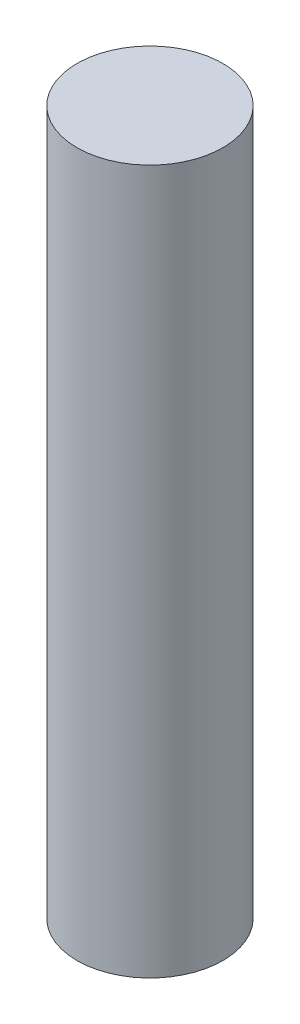
from build123d import *

# Parameters (mm, degrees)
SKETCH1_R           = 29.840301
BOSS_EXTRUDE1_DEPTH = 287.89503


with BuildPart() as part:
    # Sketch1 → Boss-Extrude1 (new body)
    with BuildSketch(Plane(origin=(0, 0, 0), x_dir=(1, 0, 0), z_dir=(0, 1, 0))):
        with Locations(Location((0, 0, 0), (0, 0, 270))):
            Circle(SKETCH1_R)
    extrude(amount=-BOSS_EXTRUDE1_DEPTH)


solid = part.part
